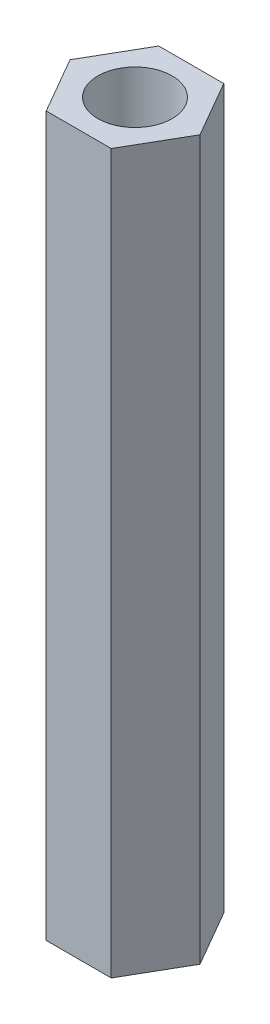
from build123d import *

# Parameters (mm, degrees)
SKETCH_1_R      = 1.55
EXTRUDE_1_DEPTH = 30


with BuildPart() as part:
    # 草图1 → 凸台-拉伸1 (new body)
    with BuildSketch(Plane(origin=(0, 0, 0), x_dir=(1, 0, 0), z_dir=(0, 1, 0))):
        Polygon((2.713546265, 0), (1.356773133, 2.35), (-1.356773133, 2.35), (-2.713546265, 0), (-1.356773133, -2.35), (1.356773133, -2.35), align=None)
        with Locations(Location((0, 0, 0), (0, 0, 270))):
            Circle(SKETCH_1_R, mode=Mode.SUBTRACT)
    extrude(amount=EXTRUDE_1_DEPTH)


solid = part.part
